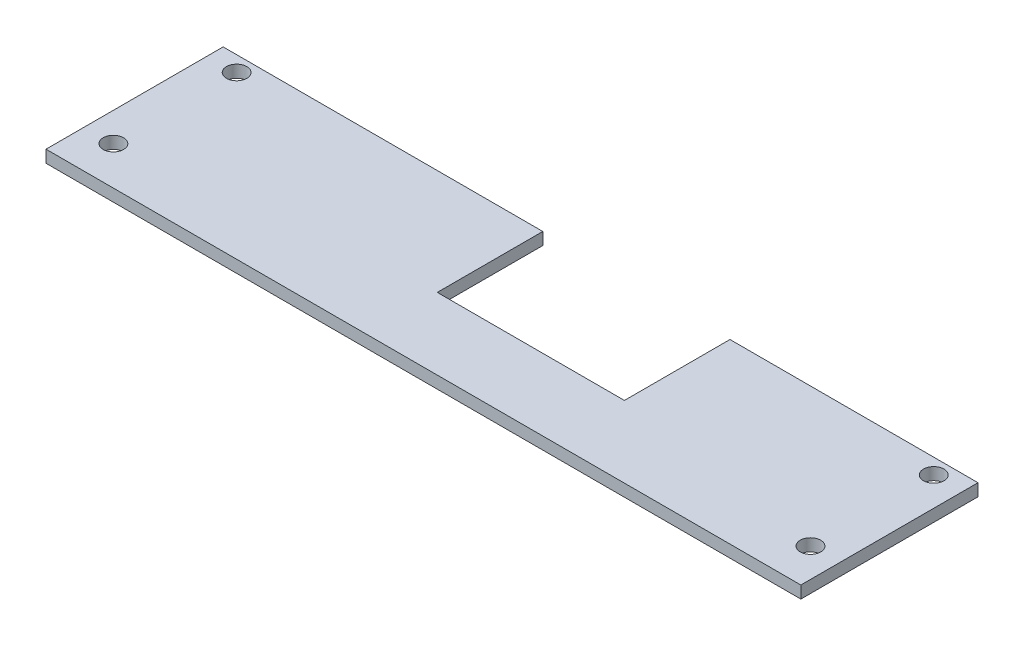
from build123d import *

# Parameters (mm, degrees)
SKETCH1_W            = 196
SKETCH1_H            = 46
BOSS_EXTRUDE1_DEPTH  = 3.175
SKETCH2_W            = 30
SKETCH2_H            = 10.018068389
SKETCH2_W_2          = 48.596040924
SKETCH2_H_2          = 27.403064809
CUT_EXTRUDE1_DEPTH   = 3.175
M5_CLEARANCE_HOLE1_D = 5.3


with BuildPart() as part:
    # Sketch1 → Boss-Extrude1 (new body)
    with BuildSketch(Plane(origin=(0, 0, 0), x_dir=(1, 0, 0), z_dir=(0, 1, 0))):
        with Locations((98, 23)):
            Rectangle(SKETCH1_W, SKETCH1_H)
    extrude(amount=BOSS_EXTRUDE1_DEPTH)

    # Sketch2 → Cut-Extrude1 (cut)
    with BuildSketch(Plane(origin=(0, 3.175, 0), x_dir=(1, 0, 0), z_dir=(0, 1, 0))):
        with Locations((98, 40.990965805)):
            Rectangle(SKETCH2_W, SKETCH2_H)
        with BuildLine():
            ThreePointArc((83, 35.981931611), (98, 20.981931611), (113, 35.981931611))
            Line((113, 35.981931611), (83, 35.981931611))
        make_face()
        with Locations((107.298020462, 32.298467596)):
            Rectangle(SKETCH2_W_2, SKETCH2_H_2)
    extrude(amount=-CUT_EXTRUDE1_DEPTH, mode=Mode.SUBTRACT)

    # M5 Clearance Hole1 (through all)
    with Locations(Plane(origin=(0, 3.175, 0), x_dir=(1, 0, 0), z_dir=(0, 1, 0))):
        with Locations((188.5, 10), (7.5, 10), (188.5, 42), (7.5, 42)):
            Hole(M5_CLEARANCE_HOLE1_D / 2)


solid = part.part
